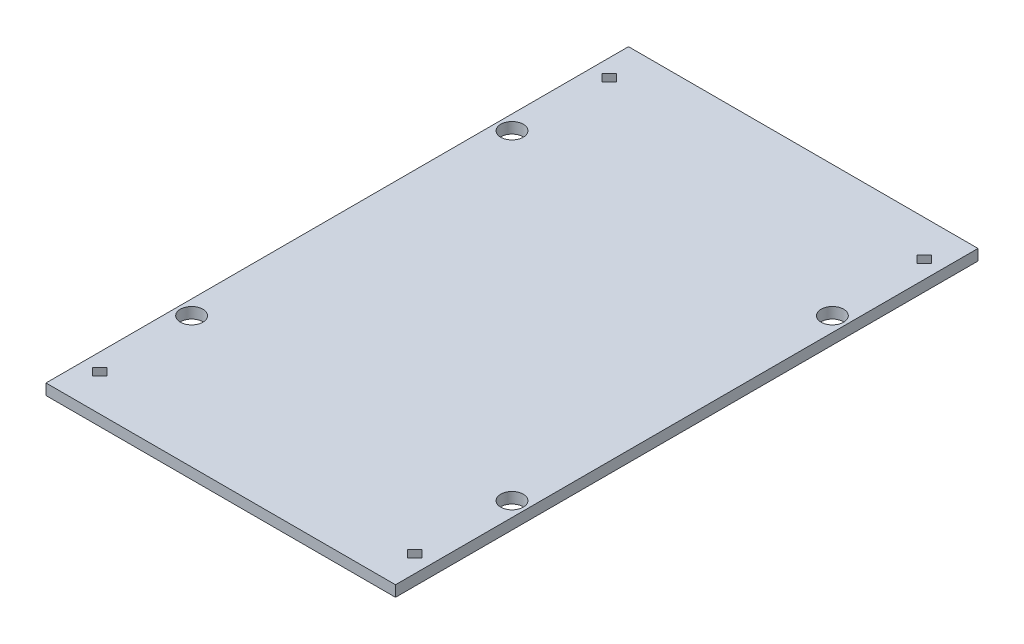
from build123d import *

# Parameters (mm, degrees)
SKETCH_1_W      = 48
SKETCH_1_H      = 80
SKETCH_1_R      = 1.55
EXTRUDE_1_DEPTH = 1.5


with BuildPart() as part:
    # 草图1 → 凸台-拉伸1 (new body)
    with BuildSketch(Plane(origin=(0, 0, 0), x_dir=(1, 0, 0), z_dir=(0, 1, 0))):
        Rectangle(SKETCH_1_W, SKETCH_1_H)
        with Locations(Location((-22, 22, 0), (0, 0, 270))):
            Circle(SKETCH_1_R, mode=Mode.SUBTRACT)
        with Locations(Location((22, 22, 0), (0, 0, 90))):
            Circle(SKETCH_1_R, mode=Mode.SUBTRACT)
        with Locations(Location((22, -22, 0), (0, 0, 270))):
            Circle(SKETCH_1_R, mode=Mode.SUBTRACT)
        with Locations(Location((-22, -22, 0), (0, 0, 90))):
            Circle(SKETCH_1_R, mode=Mode.SUBTRACT)
        Polygon((22.62, 35), (21.62, 34), (20.62, 35), (21.62, 36), align=None, mode=Mode.SUBTRACT)
        Polygon((-21.62, 34), (-20.62, 35), (-21.62, 36), (-22.62, 35), align=None, mode=Mode.SUBTRACT)
        Polygon((21.62, -36), (22.62, -35), (21.62, -34), (20.62, -35), align=None, mode=Mode.SUBTRACT)
        Polygon((-22.62, -35), (-21.62, -34), (-20.62, -35), (-21.62, -36), align=None, mode=Mode.SUBTRACT)
    extrude(amount=EXTRUDE_1_DEPTH)


solid = part.part
